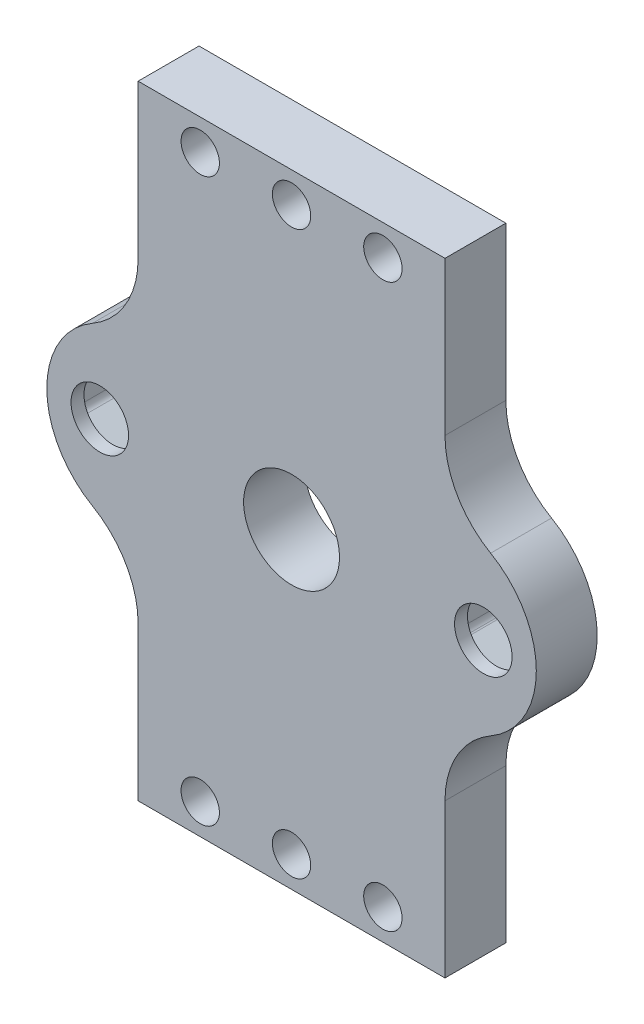
from build123d import *

# Parameters (mm, degrees)
SKETCH1_R           = 2
SKETCH1_R_2         = 3
SKETCH1_R_3         = 5
BOSS_EXTRUDE1_DEPTH = 6.35
CUT_EXTRUDE1_DEPTH  = 5


with BuildPart() as part:
    # Sketch1 → Boss-Extrude1 (new body)
    with BuildSketch(Plane.XY):
        with BuildLine():
            Line((16, 32.5), (16, 16.497783942))
            ThreePointArc((16, 16.497783942), (17.276108029, 11.735283942), (20.7625, 8.248891971))
            ThreePointArc((20.7625, 8.248891971), (25.525, 0), (20.7625, -8.248891971))
            ThreePointArc((20.7625, -8.248891971), (17.276108029, -11.735283942), (16, -16.497783942))
            Line((16, -16.497783942), (16, -32.5))
            Line((16, -32.5), (-16, -32.5))
            Line((-16, -32.5), (-16, -16.497783942))
            ThreePointArc((-16, -16.497783942), (-17.276108029, -11.735283942), (-20.7625, -8.248891971))
            ThreePointArc((-20.7625, -8.248891971), (-25.525, 0), (-20.7625, 8.248891971))
            ThreePointArc((-20.7625, 8.248891971), (-17.276108029, 11.735283942), (-16, 16.497783942))
            Line((-16, 16.497783942), (-16, 32.5))
            Line((-16, 32.5), (16, 32.5))
        make_face()
        with Locations((9.525, 29.325)):
            Circle(SKETCH1_R, mode=Mode.SUBTRACT)
        with Locations((0, 29.325)):
            Circle(SKETCH1_R, mode=Mode.SUBTRACT)
        with Locations((-9.525, 29.325)):
            Circle(SKETCH1_R, mode=Mode.SUBTRACT)
        with Locations((-20, 0)):
            Circle(SKETCH1_R_2, mode=Mode.SUBTRACT)
        with Locations((20, 0)):
            Circle(SKETCH1_R_2, mode=Mode.SUBTRACT)
        Circle(SKETCH1_R_3, mode=Mode.SUBTRACT)
        with Locations((0, -29.325)):
            Circle(SKETCH1_R, mode=Mode.SUBTRACT)
        with Locations((-9.525, -29.325)):
            Circle(SKETCH1_R, mode=Mode.SUBTRACT)
        with Locations((9.525, -29.325)):
            Circle(SKETCH1_R, mode=Mode.SUBTRACT)
    extrude(amount=BOSS_EXTRUDE1_DEPTH)

    # Sketch2 → Cut-Extrude1 (cut)
    with BuildSketch(Plane(origin=(0, 0, 0), x_dir=(-1, 0, 0), z_dir=(0, 0, -1))):
        with BuildLine():
            Line((-24.299899976, -1.987162178), (-24.299899976, 1.985705489))
            add(Edge.make_bspline(
                [(-24.299899976, 1.985705489), (-24.299899706, 1.985821791), (-24.299899435, 1.985938093), (-24.299899165, 1.986054395), (-24.299842745, 2.010309851), (-24.298834577, 2.035354853), (-24.296557164, 2.06110922), (-24.285329887, 2.188074116), (-24.246958072, 2.307490955), (-24.122405575, 2.523222207), (-24.038173467, 2.616161592), (-23.93383228, 2.689367148), (-23.91266705, 2.704216629), (-23.891481526, 2.717612229), (-23.870503895, 2.729788818), (-23.870403309, 2.729847204), (-23.870302724, 2.729905589), (-23.870202138, 2.729963975)],
                knots=[-0.29360105, -0.29360105, -0.29360105, -0.29360105, -0.293566721, -0.293566721, -0.293566721, -0.288728131, -0.288728131, -0.288728131, -0.264901782, -0.264901782, -0.241075433, -0.241075433, -0.241075433, -0.236236844, -0.236236844, -0.236236844, -0.236202514, -0.236202514, -0.236202514, -0.236202514], degree=3, weights=[1, 1, 1, 1, 1, 1, 1, 1, 1, 1, 1, 1, 1, 1, 1, 1, 1, 1]))
            Line((-23.870202138, 2.729963975), (-20.429597813, 4.716397808))
            add(Edge.make_bspline(
                [(-20.429597813, 4.716397808), (-20.429496957, 4.716455725), (-20.429396102, 4.716513641), (-20.429295246, 4.716571558), (-20.408261195, 4.728650425), (-20.386067503, 4.740299827), (-20.36262486, 4.751204713), (-20.247056396, 4.804964054), (-20.124452472, 4.831441507), (-19.87534748, 4.831441507), (-19.752743557, 4.804964054), (-19.637175092, 4.751204713), (-19.61373245, 4.740299827), (-19.591538758, 4.728650425), (-19.570504706, 4.716571558), (-19.57040385, 4.716513641), (-19.570302994, 4.716455724), (-19.570202138, 4.716397807)],
                knots=[-0.29360105, -0.29360105, -0.29360105, -0.29360105, -0.293566721, -0.293566721, -0.293566721, -0.288728131, -0.288728131, -0.288728131, -0.264901782, -0.264901782, -0.241075433, -0.241075433, -0.241075433, -0.236236844, -0.236236844, -0.236236844, -0.236202514, -0.236202514, -0.236202514, -0.236202514], degree=3, weights=[1, 1, 1, 1, 1, 1, 1, 1, 1, 1, 1, 1, 1, 1, 1, 1, 1, 1]))
            Line((-19.570202138, 4.716397807), (-16.130152765, 2.730284375))
            ThreePointArc((-16.130152765, 2.730284375), (-16.062899946, 2.687205124), (-15.999899976, 2.638115743))
            add(Edge.make_bspline(
                [(-15.999899976, 2.638115743), (-15.925548221, 2.574450329), (-15.863662698, 2.499438241), (-15.752841881, 2.307490955), (-15.714470066, 2.188074116), (-15.703242788, 2.06110922), (-15.700965376, 2.035354853), (-15.699957207, 2.010309851), (-15.699900788, 1.986054395), (-15.699900517, 1.985938092), (-15.699900247, 1.98582179), (-15.699899976, 1.985705488)],
                knots=[-0.283474511, -0.283474511, -0.283474511, -0.283474511, -0.264901782, -0.264901782, -0.241075433, -0.241075433, -0.241075433, -0.236236844, -0.236236844, -0.236236844, -0.236202514, -0.236202514, -0.236202514, -0.236202514], degree=3, weights=[1, 1, 1, 1, 1, 1, 1, 1, 1, 1, 1, 1]))
            Line((-15.699899976, 1.985705488), (-15.699899976, -1.987162179))
            add(Edge.make_bspline(
                [(-15.699899976, -1.987162179), (-15.699900247, -1.987278481), (-15.699900517, -1.987394783), (-15.699900788, -1.987511085), (-15.699957207, -2.011766541), (-15.700965376, -2.036811543), (-15.703242788, -2.062565911), (-15.714470066, -2.189530807), (-15.752841881, -2.308947645), (-15.863662698, -2.500894932), (-15.925548221, -2.575907019), (-15.999899976, -2.639572434)],
                knots=[-0.29360105, -0.29360105, -0.29360105, -0.29360105, -0.293566721, -0.293566721, -0.293566721, -0.288728131, -0.288728131, -0.288728131, -0.264901782, -0.264901782, -0.246329054, -0.246329054, -0.246329054, -0.246329054], degree=3, weights=[1, 1, 1, 1, 1, 1, 1, 1, 1, 1, 1, 1]))
            add(Edge.make_bspline(
                [(-15.999899976, -2.639572434), (-16.020931668, -2.657581308), (-16.042960832, -2.674682289), (-16.065967672, -2.690823839), (-16.087132903, -2.705673319), (-16.108318426, -2.71906892), (-16.129296058, -2.731245509), (-16.129396643, -2.731303894), (-16.129497229, -2.73136228), (-16.129597814, -2.731420665)],
                knots=[-0.246329054, -0.246329054, -0.246329054, -0.246329054, -0.241075433, -0.241075433, -0.241075433, -0.236236844, -0.236236844, -0.236236844, -0.236202514, -0.236202514, -0.236202514, -0.236202514], degree=3, weights=[1, 1, 1, 1, 1, 1, 1, 1, 1, 1]))
            Line((-16.129597814, -2.731420665), (-19.570202139, -4.717854498))
            add(Edge.make_bspline(
                [(-19.570202139, -4.717854498), (-19.570302995, -4.717912415), (-19.570403851, -4.717970332), (-19.570504706, -4.718028249), (-19.591538758, -4.730107116), (-19.61373245, -4.741756517), (-19.637175092, -4.752661404), (-19.752743557, -4.806420745), (-19.87534748, -4.832898197), (-20.124452472, -4.832898197), (-20.247056396, -4.806420745), (-20.36262486, -4.752661404), (-20.386067503, -4.741756517), (-20.408261195, -4.730107116), (-20.429295246, -4.718028249), (-20.429396102, -4.717970332), (-20.429496958, -4.717912415), (-20.429597814, -4.717854498)],
                knots=[-0.29360105, -0.29360105, -0.29360105, -0.29360105, -0.293566721, -0.293566721, -0.293566721, -0.288728131, -0.288728131, -0.288728131, -0.264901782, -0.264901782, -0.241075433, -0.241075433, -0.241075433, -0.236236844, -0.236236844, -0.236236844, -0.236202514, -0.236202514, -0.236202514, -0.236202514], degree=3, weights=[1, 1, 1, 1, 1, 1, 1, 1, 1, 1, 1, 1, 1, 1, 1, 1, 1, 1]))
            Line((-20.429597814, -4.717854498), (-23.870202139, -2.731420665))
            add(Edge.make_bspline(
                [(-23.870202139, -2.731420665), (-23.870302724, -2.731362279), (-23.87040331, -2.731303894), (-23.870503895, -2.731245509), (-23.891481526, -2.71906892), (-23.91266705, -2.705673319), (-23.93383228, -2.690823839), (-24.038173467, -2.617618283), (-24.122405575, -2.524678897), (-24.246958072, -2.308947645), (-24.285329887, -2.189530807), (-24.296557164, -2.062565911), (-24.298834577, -2.036811543), (-24.299842745, -2.011766541), (-24.299899165, -1.987511085), (-24.299899435, -1.987394783), (-24.299899706, -1.98727848), (-24.299899976, -1.987162178)],
                knots=[-0.29360105, -0.29360105, -0.29360105, -0.29360105, -0.293566721, -0.293566721, -0.293566721, -0.288728131, -0.288728131, -0.288728131, -0.264901782, -0.264901782, -0.241075433, -0.241075433, -0.241075433, -0.236236844, -0.236236844, -0.236236844, -0.236202514, -0.236202514, -0.236202514, -0.236202514], degree=3, weights=[1, 1, 1, 1, 1, 1, 1, 1, 1, 1, 1, 1, 1, 1, 1, 1, 1, 1]))
        make_face()
        with BuildLine():
            Line((15.699899976, 1.985705488), (15.699899976, -1.987162179))
            add(Edge.make_bspline(
                [(15.699899976, -1.987162179), (15.699900247, -1.987278481), (15.699900517, -1.987394783), (15.699900788, -1.987511085), (15.699957207, -2.011766541), (15.700965376, -2.036811543), (15.703242788, -2.062565911), (15.714470066, -2.189530807), (15.752841881, -2.308947645), (15.863662698, -2.500894932), (15.925548221, -2.575907019), (15.999899976, -2.639572434)],
                knots=[-0.29360105, -0.29360105, -0.29360105, -0.29360105, -0.293566721, -0.293566721, -0.293566721, -0.288728131, -0.288728131, -0.288728131, -0.264901782, -0.264901782, -0.246329054, -0.246329054, -0.246329054, -0.246329054], degree=3, weights=[1, 1, 1, 1, 1, 1, 1, 1, 1, 1, 1, 1]))
            add(Edge.make_bspline(
                [(15.999899976, -2.639572434), (16.020931668, -2.657581308), (16.042960832, -2.674682289), (16.065967672, -2.690823839), (16.087132903, -2.705673319), (16.108318426, -2.71906892), (16.129296058, -2.731245509), (16.129396643, -2.731303894), (16.129497229, -2.73136228), (16.129597814, -2.731420665)],
                knots=[-0.246329054, -0.246329054, -0.246329054, -0.246329054, -0.241075433, -0.241075433, -0.241075433, -0.236236844, -0.236236844, -0.236236844, -0.236202514, -0.236202514, -0.236202514, -0.236202514], degree=3, weights=[1, 1, 1, 1, 1, 1, 1, 1, 1, 1]))
            Line((16.129597814, -2.731420665), (19.570202139, -4.717854498))
            add(Edge.make_bspline(
                [(19.570202139, -4.717854498), (19.570302995, -4.717912415), (19.570403851, -4.717970332), (19.570504706, -4.718028249), (19.591538758, -4.730107116), (19.61373245, -4.741756517), (19.637175092, -4.752661404), (19.752743557, -4.806420745), (19.87534748, -4.832898197), (20.124452472, -4.832898197), (20.247056396, -4.806420745), (20.36262486, -4.752661404), (20.386067503, -4.741756517), (20.408261195, -4.730107116), (20.429295246, -4.718028249), (20.429396102, -4.717970332), (20.429496958, -4.717912415), (20.429597814, -4.717854498)],
                knots=[-0.29360105, -0.29360105, -0.29360105, -0.29360105, -0.293566721, -0.293566721, -0.293566721, -0.288728131, -0.288728131, -0.288728131, -0.264901782, -0.264901782, -0.241075433, -0.241075433, -0.241075433, -0.236236844, -0.236236844, -0.236236844, -0.236202514, -0.236202514, -0.236202514, -0.236202514], degree=3, weights=[1, 1, 1, 1, 1, 1, 1, 1, 1, 1, 1, 1, 1, 1, 1, 1, 1, 1]))
            Line((20.429597814, -4.717854498), (23.870202139, -2.731420665))
            add(Edge.make_bspline(
                [(23.870202139, -2.731420665), (23.870302724, -2.731362279), (23.87040331, -2.731303894), (23.870503895, -2.731245509), (23.891481526, -2.71906892), (23.91266705, -2.705673319), (23.93383228, -2.690823839), (24.038173467, -2.617618283), (24.122405575, -2.524678897), (24.246958072, -2.308947645), (24.285329887, -2.189530807), (24.296557164, -2.062565911), (24.298834577, -2.036811543), (24.299842745, -2.011766541), (24.299899165, -1.987511085), (24.299899435, -1.987394783), (24.299899706, -1.98727848), (24.299899976, -1.987162178)],
                knots=[-0.29360105, -0.29360105, -0.29360105, -0.29360105, -0.293566721, -0.293566721, -0.293566721, -0.288728131, -0.288728131, -0.288728131, -0.264901782, -0.264901782, -0.241075433, -0.241075433, -0.241075433, -0.236236844, -0.236236844, -0.236236844, -0.236202514, -0.236202514, -0.236202514, -0.236202514], degree=3, weights=[1, 1, 1, 1, 1, 1, 1, 1, 1, 1, 1, 1, 1, 1, 1, 1, 1, 1]))
            Line((24.299899976, -1.987162178), (24.299899976, 1.985705489))
            add(Edge.make_bspline(
                [(24.299899976, 1.985705489), (24.299899706, 1.985821791), (24.299899435, 1.985938093), (24.299899165, 1.986054395), (24.299842745, 2.010309851), (24.298834577, 2.035354853), (24.296557164, 2.06110922), (24.285329887, 2.188074116), (24.246958072, 2.307490955), (24.122405575, 2.523222207), (24.038173467, 2.616161592), (23.93383228, 2.689367148), (23.91266705, 2.704216629), (23.891481526, 2.717612229), (23.870503895, 2.729788818), (23.870403309, 2.729847204), (23.870302724, 2.729905589), (23.870202138, 2.729963975)],
                knots=[-0.29360105, -0.29360105, -0.29360105, -0.29360105, -0.293566721, -0.293566721, -0.293566721, -0.288728131, -0.288728131, -0.288728131, -0.264901782, -0.264901782, -0.241075433, -0.241075433, -0.241075433, -0.236236844, -0.236236844, -0.236236844, -0.236202514, -0.236202514, -0.236202514, -0.236202514], degree=3, weights=[1, 1, 1, 1, 1, 1, 1, 1, 1, 1, 1, 1, 1, 1, 1, 1, 1, 1]))
            Line((23.870202138, 2.729963975), (20.429597813, 4.716397808))
            add(Edge.make_bspline(
                [(20.429597813, 4.716397808), (20.429496957, 4.716455725), (20.429396102, 4.716513641), (20.429295246, 4.716571558), (20.408261195, 4.728650425), (20.386067503, 4.740299827), (20.36262486, 4.751204713), (20.247056396, 4.804964054), (20.124452472, 4.831441507), (19.87534748, 4.831441507), (19.752743557, 4.804964054), (19.637175092, 4.751204713), (19.61373245, 4.740299827), (19.591538758, 4.728650425), (19.570504706, 4.716571558), (19.57040385, 4.716513641), (19.570302994, 4.716455724), (19.570202138, 4.716397807)],
                knots=[-0.29360105, -0.29360105, -0.29360105, -0.29360105, -0.293566721, -0.293566721, -0.293566721, -0.288728131, -0.288728131, -0.288728131, -0.264901782, -0.264901782, -0.241075433, -0.241075433, -0.241075433, -0.236236844, -0.236236844, -0.236236844, -0.236202514, -0.236202514, -0.236202514, -0.236202514], degree=3, weights=[1, 1, 1, 1, 1, 1, 1, 1, 1, 1, 1, 1, 1, 1, 1, 1, 1, 1]))
            Line((19.570202138, 4.716397807), (16.130152765, 2.730284375))
            ThreePointArc((16.130152765, 2.730284375), (16.062899946, 2.687205124), (15.999899976, 2.638115743))
            add(Edge.make_bspline(
                [(15.999899976, 2.638115743), (15.925548221, 2.574450329), (15.863662698, 2.499438241), (15.752841881, 2.307490955), (15.714470066, 2.188074116), (15.703242788, 2.06110922), (15.700965376, 2.035354853), (15.699957207, 2.010309851), (15.699900788, 1.986054395), (15.699900517, 1.985938092), (15.699900247, 1.98582179), (15.699899976, 1.985705488)],
                knots=[-0.283474511, -0.283474511, -0.283474511, -0.283474511, -0.264901782, -0.264901782, -0.241075433, -0.241075433, -0.241075433, -0.236236844, -0.236236844, -0.236236844, -0.236202514, -0.236202514, -0.236202514, -0.236202514], degree=3, weights=[1, 1, 1, 1, 1, 1, 1, 1, 1, 1, 1, 1]))
        make_face()
    extrude(amount=-CUT_EXTRUDE1_DEPTH, mode=Mode.SUBTRACT)


solid = part.part
